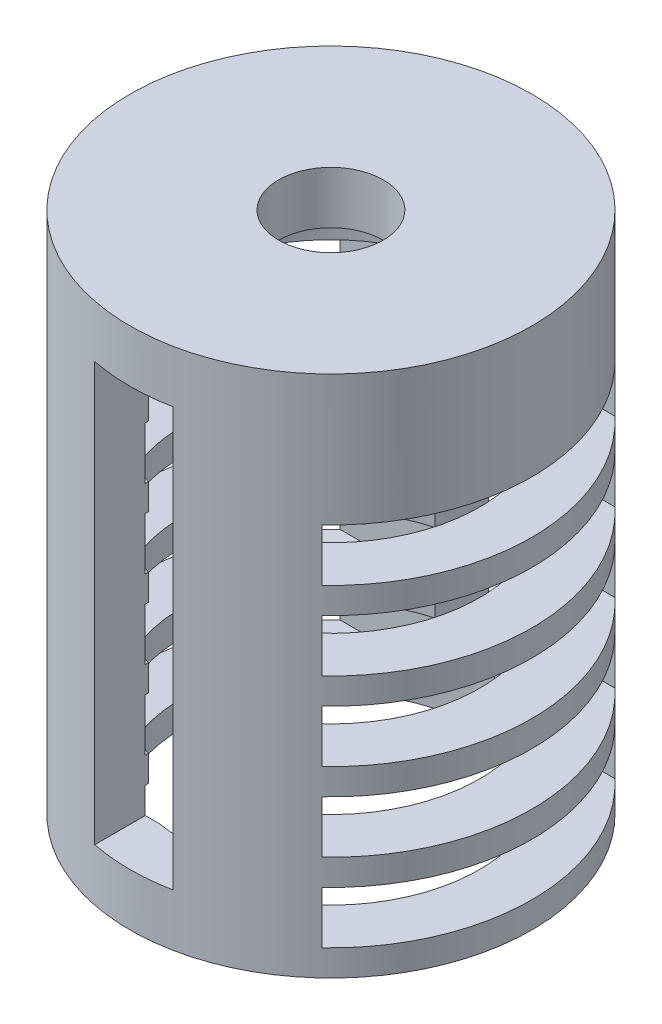
from build123d import *

# Parameters (mm, degrees)
SKETCH1_W          = 5.842
SKETCH1_H          = 3.175
SKETCH1_W_2        = 3.175
SKETCH1_H_2        = 31.75
SKETCH2_W          = 4.7625
SKETCH2_H          = 25.4
CUT_EXTRUDE1_DEPTH = 25.4
SKETCH3_W          = 17.78
SKETCH3_H          = 3.175
CUT_EXTRUDE2_DEPTH = 25.4


with BuildPart() as part:
    # Sketch1 → Revolve1 (revolve)
    with BuildSketch(Plane.XY, mode=Mode.PRIVATE) as revolve1_sk:
        with Locations((6.096, 14.2875)):
            Rectangle(SKETCH1_W, SKETCH1_H)
        with Locations((10.6045, 0)):
            Rectangle(SKETCH1_W_2, SKETCH1_H_2)
    revolve(revolve1_sk.sketch.rotate(Axis((0, 0, 0), (0, 1, 0)), 90), axis=Axis((0, 0, 0), (0, 1, 0)))

    # Sketch2 → Cut-Extrude1 (cut, symmetric)
    with BuildSketch(Plane.XY):
        Rectangle(SKETCH2_W, SKETCH2_H)
    extrude(amount=CUT_EXTRUDE1_DEPTH, both=True, mode=Mode.SUBTRACT)

    # Sketch3 → Cut-Extrude2 (cut, symmetric)
    with BuildSketch(Plane(origin=(0, 0, 0), x_dir=(0, 0, -1), z_dir=(1, 0, 0))):
        with Locations((0, -12.7)):
            Rectangle(SKETCH3_W, SKETCH3_H)
        with Locations((0, -7.9375)):
            Rectangle(SKETCH3_W, SKETCH3_H)
        with Locations((0, -3.175)):
            Rectangle(SKETCH3_W, SKETCH3_H)
        with Locations((0, 1.5875)):
            Rectangle(SKETCH3_W, SKETCH3_H)
        with Locations((0, 6.35)):
            Rectangle(SKETCH3_W, SKETCH3_H)
    extrude(amount=CUT_EXTRUDE2_DEPTH, both=True, mode=Mode.SUBTRACT)


solid = part.part
